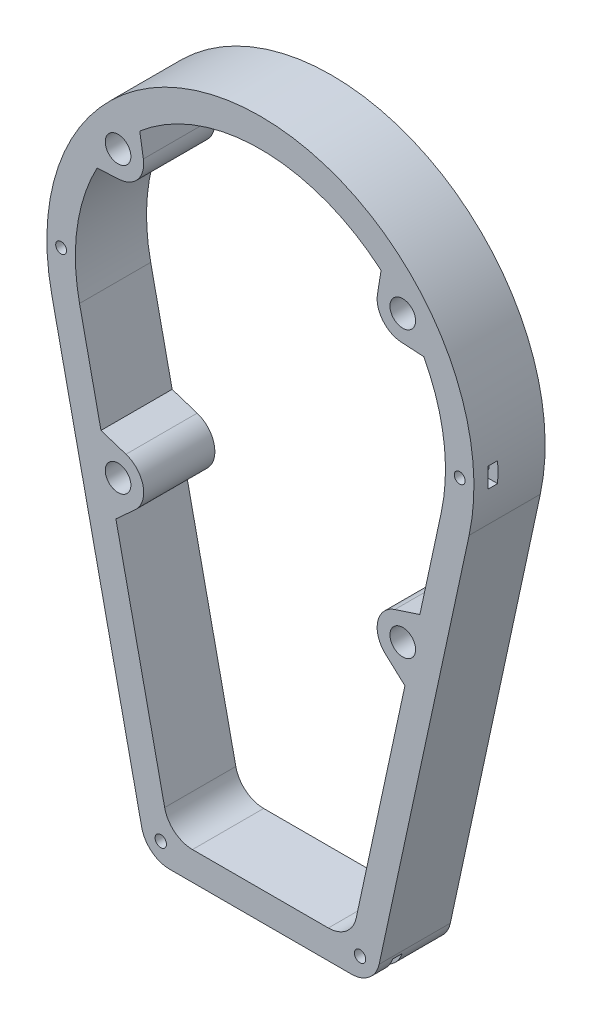
from build123d import *

# Parameters (mm, degrees)
BOSS_EXTRUDE1_DEPTH = 25
SKETCH1_R           = 1.9
SKETCH1_R_2         = 2
CUT_EXTRUDE2_DEPTH  = 188.483332593
FILLET1_R           = 10
CUT_EXTRUDE6_START  = -5
CUT_EXTRUDE6_DEPTH  = 3.4
BOSS_EXTRUDE2_DEPTH = 25
SKETCH5_R           = 4.5
CUT_EXTRUDE7_DEPTH  = 25


with BuildPart() as part:
    # Sketch2 → Boss-Extrude1 (new body)
    with BuildSketch(Plane.XY):
        with BuildLine():
            Line((-40, -170), (40, -170))
            Line((40, -170), (73.308387301, -15.839202988))
            ThreePointArc((73.308387301, -15.839202988), (0, 75), (-73.308387301, -15.839202988))
            Line((-73.308387301, -15.839202988), (-40, -170))
        make_face()
        with BuildLine():
            Line((-63.533935661, -13.727309256), (-31.929873349, -160))
            Line((-31.929873349, -160), (31.929873349, -160))
            Line((31.929873349, -160), (63.533935661, -13.727309256))
            ThreePointArc((63.533935661, -13.727309256), (0, 65), (-63.533935661, -13.727309256))
        make_face(mode=Mode.SUBTRACT)
    extrude(amount=BOSS_EXTRUDE1_DEPTH)

    # Sketch1 → Cut-Extrude2 (cut, through all)
    with BuildSketch(Plane.XY):
        with Locations((-70, 0)):
            Circle(SKETCH1_R)
        with Locations((70, 0)):
            Circle(SKETCH1_R)
        with Locations((-35, -163)):
            Circle(SKETCH1_R_2)
        with Locations((35, -163)):
            Circle(SKETCH1_R_2)
    extrude(amount=CUT_EXTRUDE2_DEPTH, mode=Mode.SUBTRACT)

    # Fillet1
    fillet1_edges = [part.edges().sort_by_distance(p)[0] for p in [
        (-31.929873349, -160, 12.5),
        (31.929873349, -160, 12.5),
        (40, -170, 12.5),
        (-40, -170, 12.5),
    ]]
    fillet(fillet1_edges, radius=FILLET1_R)

    # Sketch4 → Cut-Extrude6 (cut)
    with BuildSketch(Plane.XY.offset(25).offset(CUT_EXTRUDE6_START)):
        Polygon((-65.958548116, 0), (-67.979274058, 3.5), (-72.020725942, 3.5), (-78.181853636, 3.5), (-78.181853636, -3.5), (-72.020725942, -3.5), (-67.979274058, -3.5), align=None)
        Polygon((72.020725942, 3.5), (67.979274058, 3.5), (65.958548116, 0), (67.979274058, -3.5), (72.020725942, -3.5), (78.79506668, -3.5), (78.79506668, 3.5), align=None)
        Polygon((31.689436427, -160.681918431), (31.337200686, -164.70799137), (34.647764259, -167.02607294), (39.092604068, -170.13838328), (43.107639123, -164.40431897), (38.662799314, -161.29200863), (35.352235741, -158.97392706), align=None)
        Polygon((-34.647764259, -167.02607294), (-31.337200686, -164.70799137), (-31.689436427, -160.681918431), (-35.352235741, -158.97392706), (-38.662799314, -161.29200863), (-44.154927164, -165.137637951), (-40.139892109, -170.871702261), align=None)
    extrude(amount=-CUT_EXTRUDE6_DEPTH, mode=Mode.SUBTRACT)

    # Sketch6 → Boss-Extrude2 (add)
    with BuildSketch(Plane.XY.offset(25)):
        with BuildLine():
            Line((-50.755351044, -72.870274401), (-56.001491632, -48.589626801))
            Line((-56.001491632, -48.589626801), (-47.2213069, -51.43969249))
            ThreePointArc((-47.2213069, -51.43969249), (-41.202993524, -58.099295641), (-43.935030997, -66.649522613))
            Line((-43.935030997, -66.649522613), (-50.755351044, -72.870274401))
        make_face()
        with BuildLine():
            Line((43.935030997, -66.649522613), (50.755351044, -72.870274401))
            Line((50.755351044, -72.870274401), (56.001491632, -48.589626801))
            Line((56.001491632, -48.589626801), (47.2213069, -51.43969249))
            ThreePointArc((47.2213069, -51.43969249), (41.202993524, -58.099295641), (43.935030997, -66.649522613))
        make_face()
        with BuildLine():
            Line((-58.888367545, 30.440309427), (-42.624577683, 50.770046755))
            Line((-42.624577683, 50.770046755), (-41.11539724, 41.436604954))
            ThreePointArc((-41.11539724, 41.436604954), (-42.972180715, 34.377744572), (-49.451287154, 31.016742561))
            Line((-49.451287154, 31.016742561), (-58.888367545, 30.440309427))
        make_face()
        with BuildLine():
            Line((49.451287154, 31.016742561), (58.888367545, 30.440309427))
            Line((58.888367545, 30.440309427), (42.624577683, 50.770046755))
            Line((42.624577683, 50.770046755), (41.11539724, 41.436604954))
            ThreePointArc((41.11539724, 41.436604954), (42.972180715, 34.377744572), (49.451287154, 31.016742561))
        make_face()
    extrude(amount=-BOSS_EXTRUDE2_DEPTH)

    # Sketch5 → Cut-Extrude7 (cut)
    with BuildSketch(Plane.XY):
        with Locations((50, -60)):
            Circle(SKETCH5_R)
        with Locations((-50, -60)):
            Circle(SKETCH5_R)
        with Locations((-50, 40)):
            Circle(SKETCH5_R)
        with Locations((50, 40)):
            Circle(SKETCH5_R)
    extrude(amount=CUT_EXTRUDE7_DEPTH, mode=Mode.SUBTRACT)


solid = part.part
